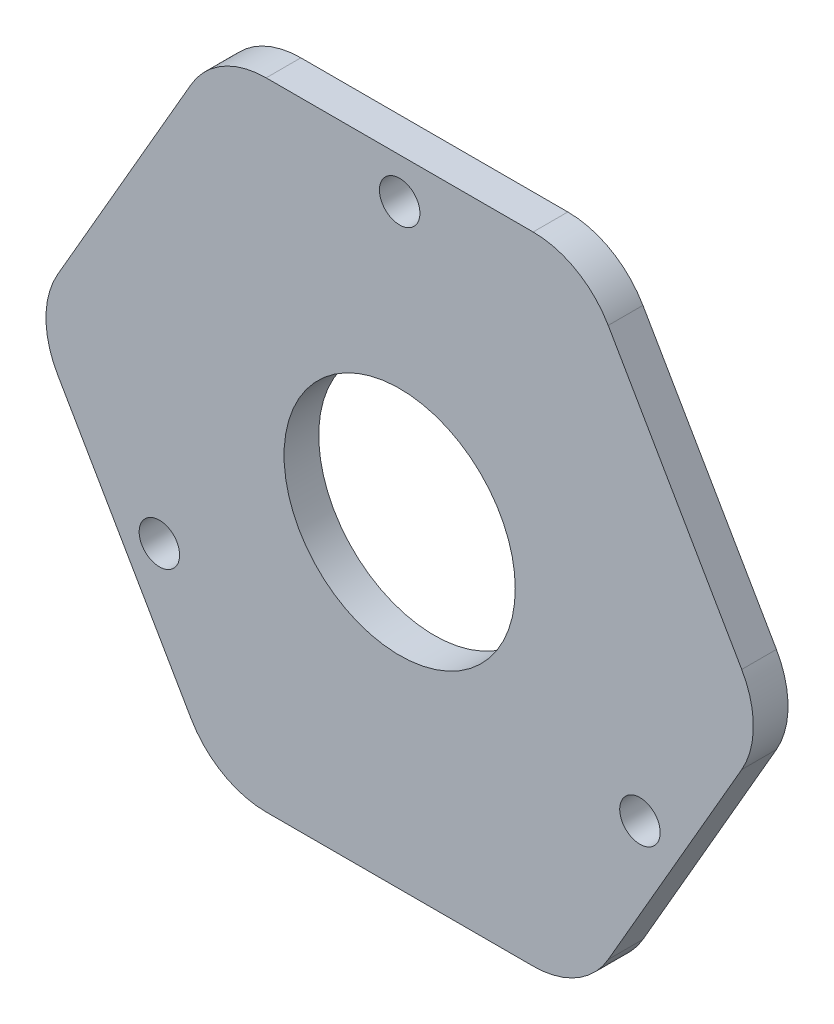
from build123d import *

# Parameters (mm, degrees)
SKETCH_1_R      = 1.75
SKETCH_1_R_2    = 10
EXTRUDE_1_DEPTH = 3


with BuildPart() as part:
    # Эскиз1 → Бобышка-Вытянуть1 (new body)
    with BuildSketch(Plane.XY):
        with BuildLine():
            Line((29.589201296, 3.75), (18.042195912, 23.75))
            ThreePointArc((18.042195912, 23.75), (15.297005384, 26.495190528), (11.547005384, 27.5))
            Line((11.547005384, 27.5), (-11.547005384, 27.5))
            ThreePointArc((-11.547005384, 27.5), (-15.297005384, 26.495190528), (-18.042195912, 23.75))
            Line((-18.042195912, 23.75), (-29.589201296, 3.75))
            ThreePointArc((-29.589201296, 3.75), (-30.594010768, 0), (-29.589201296, -3.75))
            Line((-29.589201296, -3.75), (-18.042195912, -23.75))
            ThreePointArc((-18.042195912, -23.75), (-15.297005384, -26.495190528), (-11.547005384, -27.5))
            Line((-11.547005384, -27.5), (11.547005384, -27.5))
            ThreePointArc((11.547005384, -27.5), (15.297005384, -26.495190528), (18.042195912, -23.75))
            Line((18.042195912, -23.75), (29.589201296, -3.75))
            ThreePointArc((29.589201296, -3.75), (30.594010768, 0), (29.589201296, 3.75))
        make_face()
        with Locations((0, 24)):
            Circle(SKETCH_1_R, mode=Mode.SUBTRACT)
        with Locations((20.784609691, -12)):
            Circle(SKETCH_1_R, mode=Mode.SUBTRACT)
        with Locations((-20.784609691, -12)):
            Circle(SKETCH_1_R, mode=Mode.SUBTRACT)
        Circle(SKETCH_1_R_2, mode=Mode.SUBTRACT)
    extrude(amount=EXTRUDE_1_DEPTH)


solid = part.part
